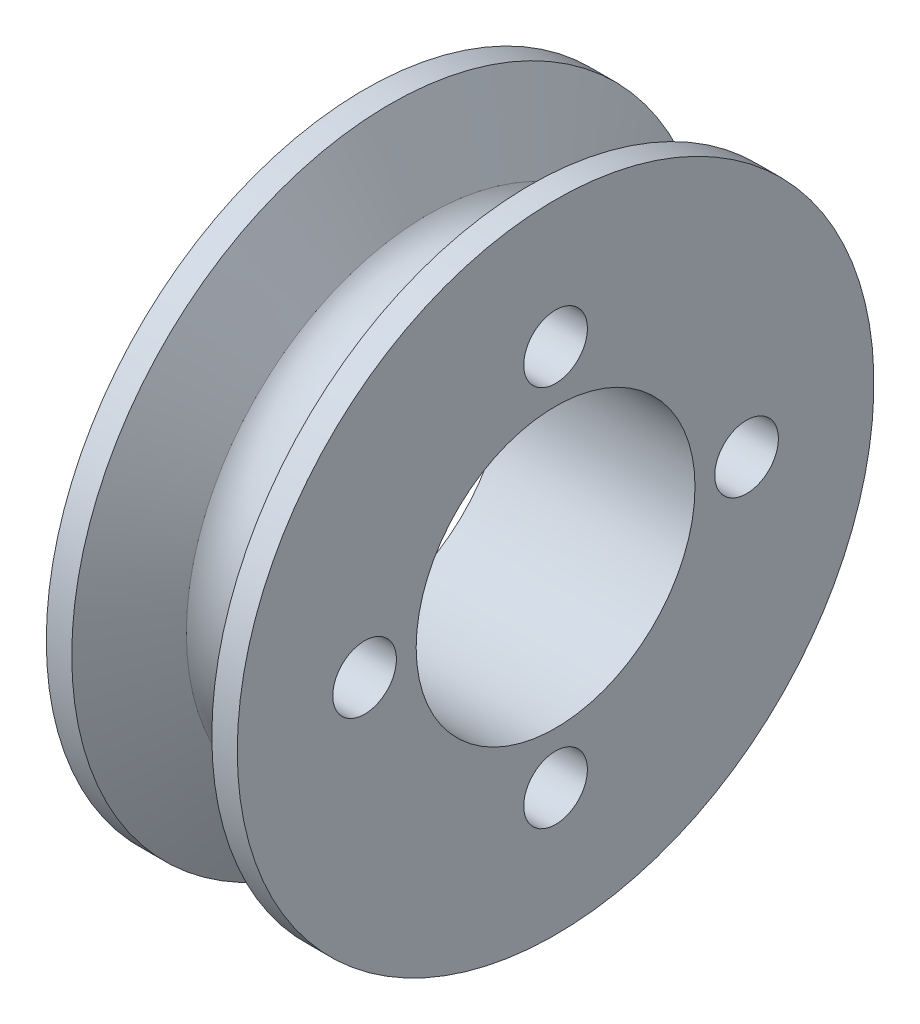
from build123d import *

# Parameters (mm, degrees)
CROQUIS2_R            = 3.95
CORTAR_EXTRUIR1_DEPTH = 14
CROQUIS3_R            = 10.95
CORTAR_EXTRUIR2_DEPTH = 115.8
CROQUIS4_R            = 2.5
CORTAR_EXTRUIR3_DEPTH = 43


with BuildPart() as part:
    # Croquis1 → Revolución1 (revolve)
    with BuildSketch(Plane.XY, mode=Mode.PRIVATE) as revoluci_n1_sk:
        with BuildLine():
            Line((5.952239129, 4.74561549), (2.952239129, -1.25438451))
            ThreePointArc((2.952239129, -1.25438451), (0.452239129, -2.455946629), (-2.047760871, -1.25438451))
            Line((-2.047760871, -1.25438451), (-5.047760871, 4.74561549))
            Line((-5.047760871, 4.74561549), (-7.047760871, 4.74561549))
            Line((-7.047760871, 4.74561549), (-7.047760871, -20.25438451))
            Line((-7.047760871, -20.25438451), (7.952239129, -20.25438451))
            Line((7.952239129, -20.25438451), (7.952239129, 4.74561549))
            Line((7.952239129, 4.74561549), (5.952239129, 4.74561549))
        make_face()
    revolve(revoluci_n1_sk.sketch.rotate(Axis((-20.844407183, -20.25438451, 0), (1, 0, 0)), 90), axis=Axis((-20.844407183, -20.25438451, 0), (1, 0, 0)))

    # Croquis2 → Cortar-Extruir1 (cut)
    with BuildSketch(Plane.ZY.offset(7.047760871)):
        with Locations((0, -20.25438451)):
            Circle(CROQUIS2_R)
    extrude(amount=-CORTAR_EXTRUIR1_DEPTH, mode=Mode.SUBTRACT)

    # Croquis3 → Cortar-Extruir2 (cut)
    with BuildSketch(Plane.ZY.offset(7.047760871)):
        with Locations((0, -20.25438451)):
            Circle(CROQUIS3_R)
    extrude(amount=-CORTAR_EXTRUIR2_DEPTH, mode=Mode.SUBTRACT)

    # Croquis4 → Cortar-Extruir3 (cut)
    with BuildSketch(Plane(origin=(7.952239129, 0, 0), x_dir=(0, 0, -1), z_dir=(1, 0, 0))):
        with Locations((-15, -20.25438451)):
            Circle(CROQUIS4_R)
        with Locations((0, -35.25438451)):
            Circle(CROQUIS4_R)
        with Locations((15, -20.25438451)):
            Circle(CROQUIS4_R)
        with Locations((0, -5.25438451)):
            Circle(CROQUIS4_R)
    extrude(amount=-CORTAR_EXTRUIR3_DEPTH, mode=Mode.SUBTRACT)


solid = part.part
